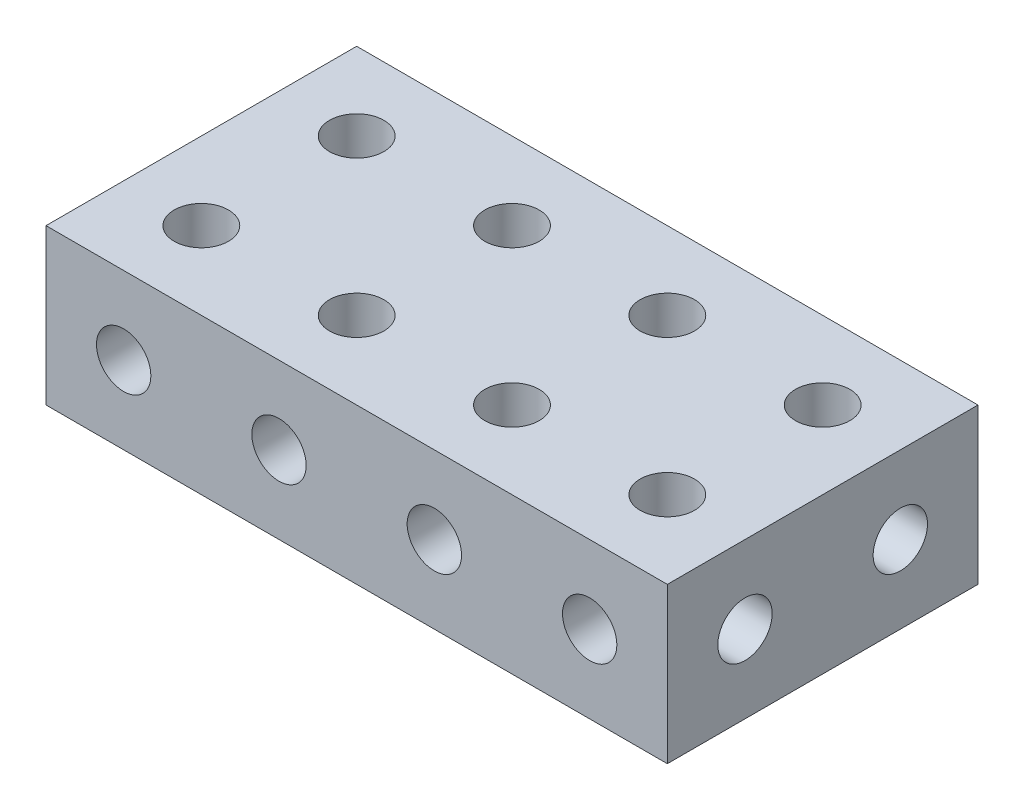
from build123d import *

# Parameters (mm, degrees)
ESQUISSE1_W             = 20
ESQUISSE1_H             = 10
BOSS_EXTRU_1_DEPTH      = 40
ESQUISSE2_R             = 1.75
ENL_V_MAT_EXTRU_1_DEPTH = 46.82575695
ESQUISSE3_R             = 1.75
ENL_V_MAT_EXTRU_2_DEPTH = 40
ESQUISSE4_R             = 1.75
ENL_V_MAT_EXTRU_3_DEPTH = 40


with BuildPart() as part:
    # Esquisse1 → Boss.-Extru.1 (new body)
    with BuildSketch(Plane(origin=(0, 0, 0), x_dir=(0, 0, -1), z_dir=(1, 0, 0))):
        with Locations((10, 5)):
            Rectangle(ESQUISSE1_W, ESQUISSE1_H)
    extrude(amount=BOSS_EXTRU_1_DEPTH)

    # Esquisse2 → Enlèv. mat.-Extru.1 (cut, through all)
    with BuildSketch(Plane(origin=(0, 10, 0), x_dir=(1, 0, 0), z_dir=(0, 1, 0))):
        with Locations(Location((5, 15, 0), (0, 0, 270))):
            Circle(ESQUISSE2_R)
        with Locations(Location((15, 15, 0), (0, 0, 270))):
            Circle(ESQUISSE2_R)
        with Locations(Location((25, 15, 0), (0, 0, 270))):
            Circle(ESQUISSE2_R)
        with Locations(Location((35, 15, 0), (0, 0, 270))):
            Circle(ESQUISSE2_R)
        with Locations(Location((5, 5, 0), (0, 0, 270))):
            Circle(ESQUISSE2_R)
        with Locations(Location((15, 5, 0), (0, 0, 270))):
            Circle(ESQUISSE2_R)
        with Locations(Location((25, 5, 0), (0, 0, 270))):
            Circle(ESQUISSE2_R)
        with Locations(Location((35, 5, 0), (0, 0, 270))):
            Circle(ESQUISSE2_R)
        with Locations((5, -5)):
            Circle(ESQUISSE2_R)
        with Locations((15, -5)):
            Circle(ESQUISSE2_R)
        with Locations((25, -5)):
            Circle(ESQUISSE2_R)
        with Locations((35, -5)):
            Circle(ESQUISSE2_R)
        with Locations((5, -15)):
            Circle(ESQUISSE2_R)
        with Locations((15, -15)):
            Circle(ESQUISSE2_R)
        with Locations((25, -15)):
            Circle(ESQUISSE2_R)
        with Locations((35, -15)):
            Circle(ESQUISSE2_R)
    extrude(amount=-ENL_V_MAT_EXTRU_1_DEPTH, mode=Mode.SUBTRACT)

    # Esquisse3 → Enlèv. mat.-Extru.2 (cut)
    with BuildSketch(Plane.XY):
        with Locations((5, 5)):
            Circle(ESQUISSE3_R)
        with Locations((15, 5)):
            Circle(ESQUISSE3_R)
        with Locations((25, 5)):
            Circle(ESQUISSE3_R)
        with Locations((35, 5)):
            Circle(ESQUISSE3_R)
    extrude(amount=-ENL_V_MAT_EXTRU_2_DEPTH, mode=Mode.SUBTRACT)

    # Esquisse4 → Enlèv. mat.-Extru.3 (cut)
    with BuildSketch(Plane(origin=(40, 0, 0), x_dir=(0, 0, -1), z_dir=(1, 0, 0))):
        with Locations((5, 5)):
            Circle(ESQUISSE4_R)
        with Locations(Location((15, 5, 0), (0, 0, 315))):
            Circle(ESQUISSE4_R)
        with Locations((25, 5)):
            Circle(ESQUISSE4_R)
        with Locations((35, 5)):
            Circle(ESQUISSE4_R)
    extrude(amount=-ENL_V_MAT_EXTRU_3_DEPTH, mode=Mode.SUBTRACT)


solid = part.part
